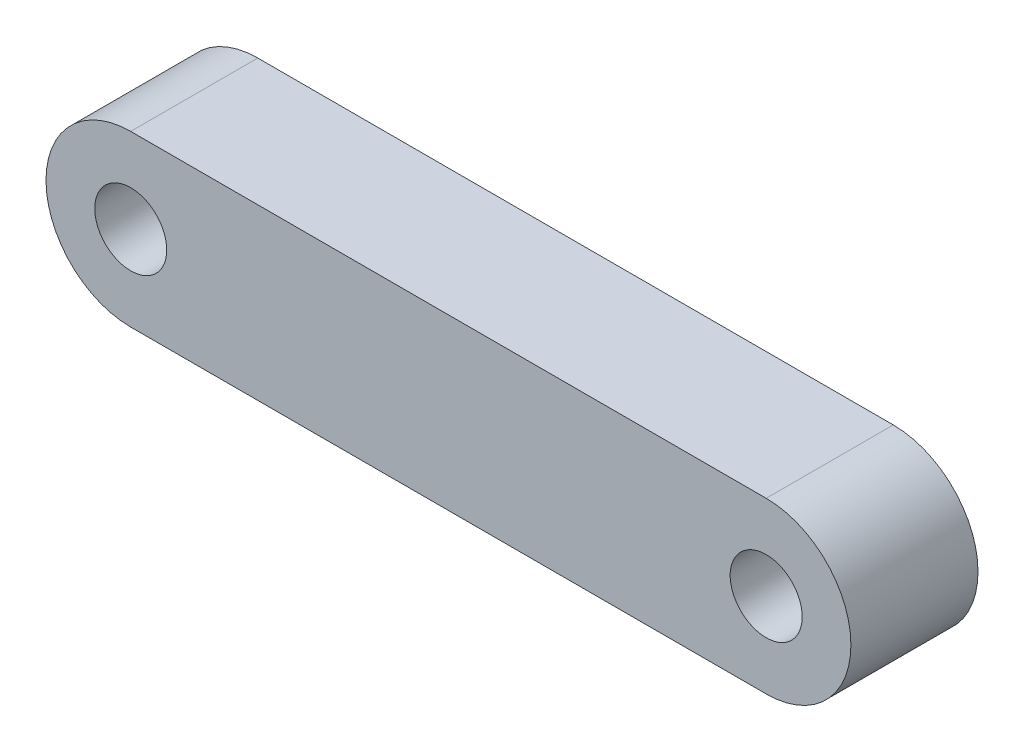
from build123d import *

# Parameters (mm, degrees)
EXTRUDE_1_DEPTH     = 6
SKETCH_2_R          = 1.7
CUT_EXTRUDE_1_DEPTH = 10


with BuildPart() as part:
    # 草图1 → 凸台-拉伸1 (new body)
    with BuildSketch(Plane.XY):
        with BuildLine():
            Line((0, 4), (30, 4))
            ThreePointArc((30, 4), (34, 0), (30, -4))
            Line((30, -4), (0, -4))
            ThreePointArc((0, -4), (-4, 0), (0, 4))
        make_face()
    extrude(amount=EXTRUDE_1_DEPTH)

    # 草图2 → 切除-拉伸1 (cut)
    with BuildSketch(Plane.XY.offset(6)):
        Circle(SKETCH_2_R)
        with Locations((30, 0)):
            Circle(SKETCH_2_R)
    extrude(amount=-CUT_EXTRUDE_1_DEPTH, mode=Mode.SUBTRACT)


solid = part.part
